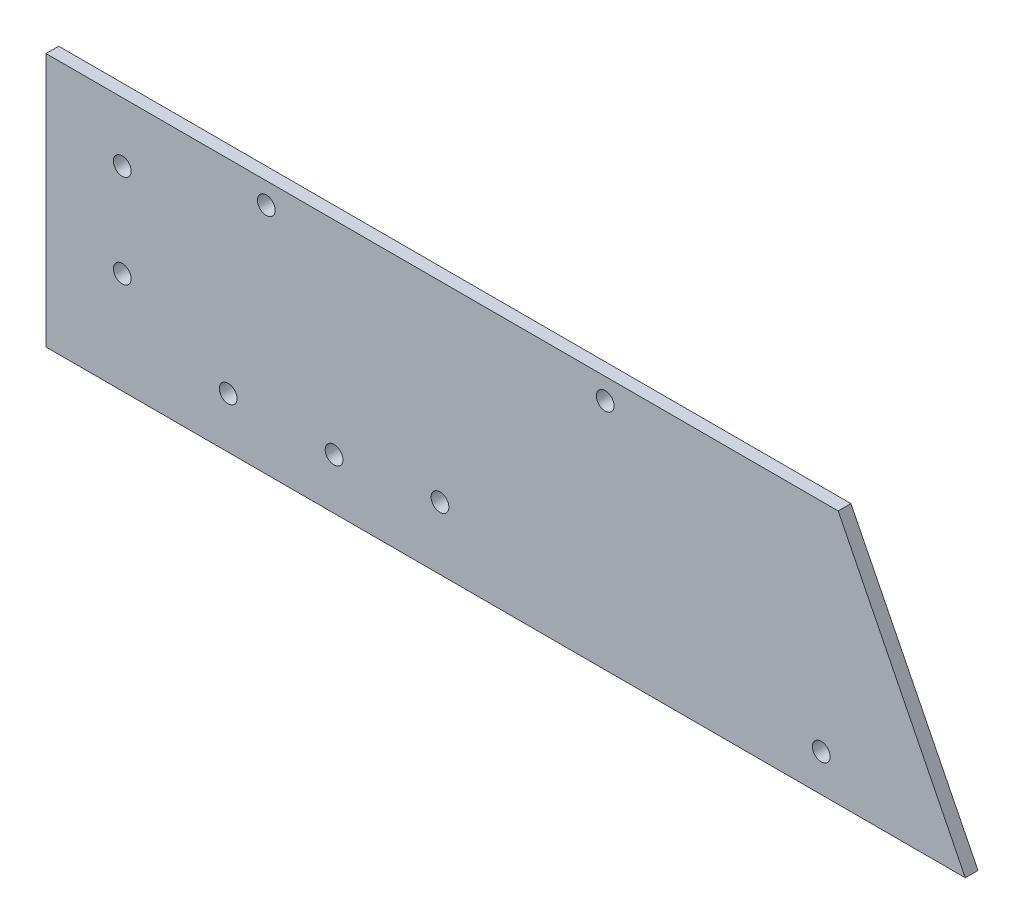
from build123d import *

# Parameters (mm, degrees)
SZKIC1_W                    = 217
SZKIC1_H                    = 60
DODANIE_WYCI_GNI_CIE1_DEPTH = 3
WYTNIJ_WYCI_GNI_CIE1_DEPTH  = 226.162163784
SZKIC3_R                    = 2.1
WYTNIJ_WYCI_GNI_CIE2_DEPTH  = 226.162163784
SZKIC4_R                    = 2.1
WYTNIJ_WYCI_GNI_CIE3_DEPTH  = 226.162163784
SZKIC5_R                    = 2.1
WYTNIJ_WYCI_GNI_CIE4_DEPTH  = 226.162163784
SZKIC6_R                    = 2.1
WYTNIJ_WYCI_GNI_CIE5_DEPTH  = 226.162163784


with BuildPart() as part:
    # Szkic1 → Dodanie-wyciągnięcie1 (new body)
    with BuildSketch(Plane.XY):
        with Locations((108.5, 30)):
            Rectangle(SZKIC1_W, SZKIC1_H)
    extrude(amount=DODANIE_WYCI_GNI_CIE1_DEPTH)

    # Szkic2 → Wytnij-wyciągnięcie1 (cut, through all)
    with BuildSketch(Plane.XY.offset(3)):
        Polygon((187, 60), (217, 0), (217, 60), align=None)
    extrude(amount=-WYTNIJ_WYCI_GNI_CIE1_DEPTH, mode=Mode.SUBTRACT)

    # Szkic3 → Wytnij-wyciągnięcie2 (cut, through all)
    with BuildSketch(Plane(origin=(0, 0, 0), x_dir=(-1, 0, 0), z_dir=(0, 0, -1))):
        with Locations((-18, 24)):
            Circle(SZKIC3_R)
        with Locations((-43, 12)):
            Circle(SZKIC3_R)
        with Locations((-68, 12)):
            Circle(SZKIC3_R)
    extrude(amount=-WYTNIJ_WYCI_GNI_CIE2_DEPTH, mode=Mode.SUBTRACT)

    # Szkic4 → Wytnij-wyciągnięcie3 (cut, through all)
    with BuildSketch(Plane.XY.offset(3)):
        with Locations((93, 14.8)):
            Circle(SZKIC4_R)
        with Locations((183, 8.8)):
            Circle(SZKIC4_R)
    extrude(amount=-WYTNIJ_WYCI_GNI_CIE3_DEPTH, mode=Mode.SUBTRACT)

    # Szkic5 → Wytnij-wyciągnięcie4 (cut, through all)
    with BuildSketch(Plane.XY.offset(3)):
        with Locations((18, 46)):
            Circle(SZKIC5_R)
    extrude(amount=-WYTNIJ_WYCI_GNI_CIE4_DEPTH, mode=Mode.SUBTRACT)

    # Szkic6 → Wytnij-wyciągnięcie5 (cut, through all)
    with BuildSketch(Plane(origin=(0, 0, 0), x_dir=(-1, 0, 0), z_dir=(0, 0, -1))):
        with Locations((-52, 55)):
            Circle(SZKIC6_R)
        with Locations((-132, 55)):
            Circle(SZKIC6_R)
    extrude(amount=-WYTNIJ_WYCI_GNI_CIE5_DEPTH, mode=Mode.SUBTRACT)


solid = part.part
